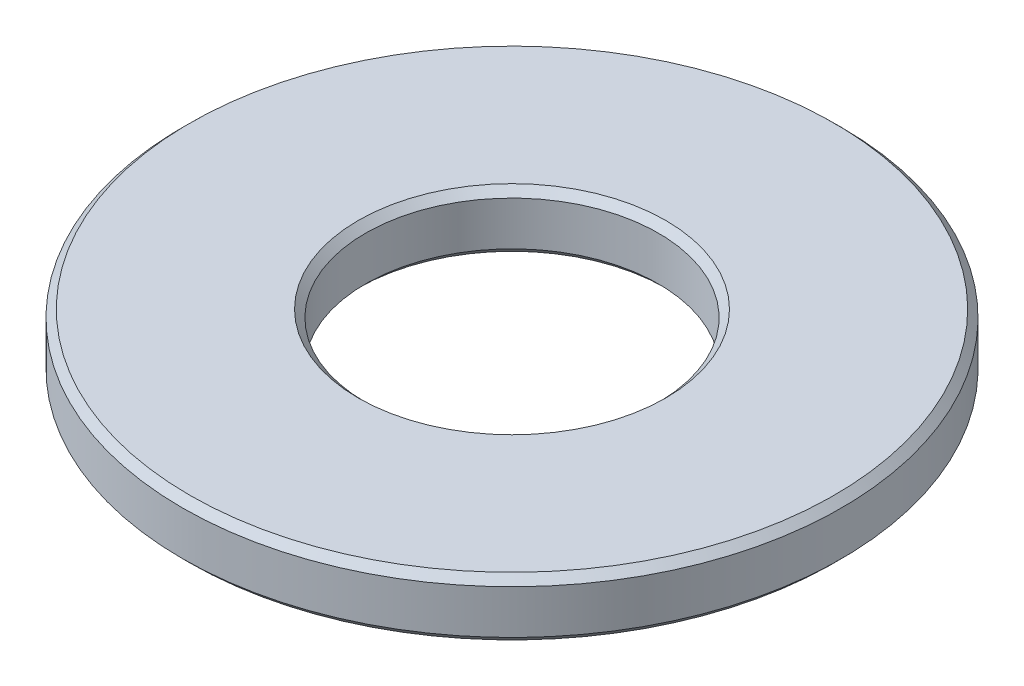
from build123d import *

# Parameters (mm, degrees)
CROQUIS1_R              = 4.5
CROQUIS1_R_2            = 2
SALIENTE_EXTRUIR1_DEPTH = 0.8
CHAFL_N1_SIZE           = 0.1


with BuildPart() as part:
    # Croquis1 → Saliente-Extruir1 (new body)
    with BuildSketch(Plane(origin=(0, 0, 0), x_dir=(1, 0, 0), z_dir=(0, 1, 0))):
        with Locations(Location((0, 0, 0), (0, 0, 270))):
            Circle(CROQUIS1_R)
        with Locations(Location((0, 0, 0), (0, 0, 270))):
            Circle(CROQUIS1_R_2, mode=Mode.SUBTRACT)
    extrude(amount=SALIENTE_EXTRUIR1_DEPTH)

    # Chaflán1
    chafl_n1_edges = [part.edges().sort_by_distance(p)[0] for p in [
        (0, 0, -4.5),
        (0, 0.8, -4.5),
        (0, 0, -2),
        (0, 0.8, -2),
    ]]
    chamfer(chafl_n1_edges, length=CHAFL_N1_SIZE)


solid = part.part
